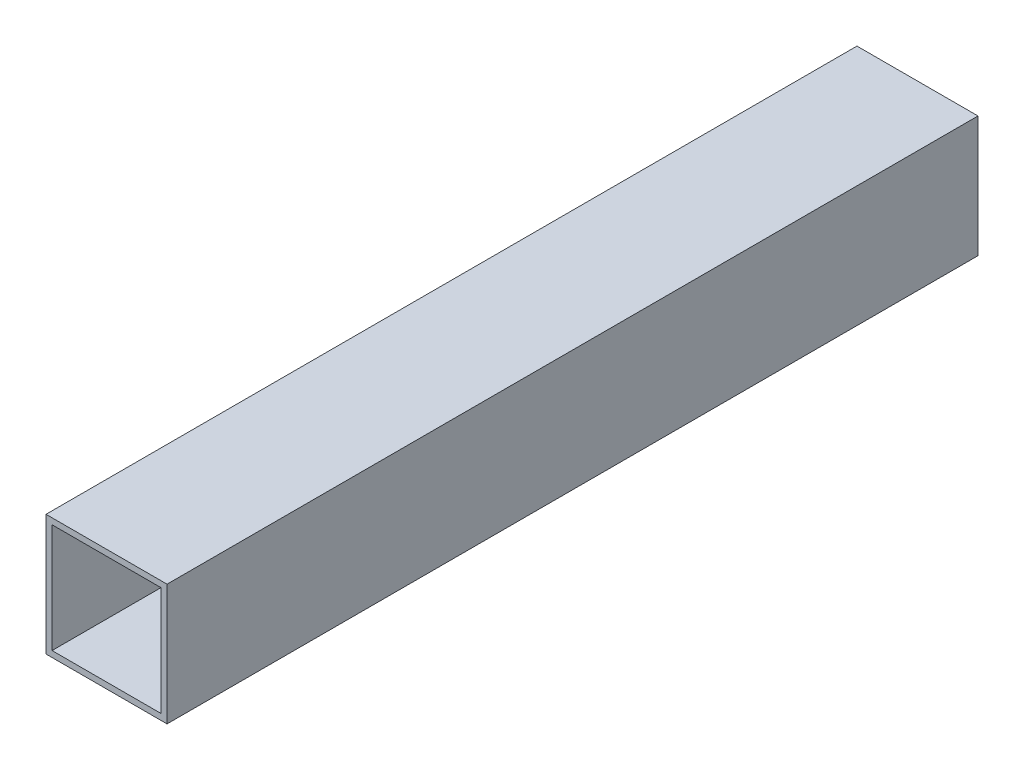
from build123d import *

# Parameters (mm, degrees)
CROQUIS1_W            = 40
CROQUIS1_H            = 40
CROQUIS1_W_2          = 36
CROQUIS1_H_2          = 36
EXTRUIR_L_MINA1_DEPTH = 268


with BuildPart() as part:
    # Croquis1 → Extruir-Lámina1 (new body)
    with BuildSketch(Plane.XY):
        Rectangle(CROQUIS1_W, CROQUIS1_H)
        Rectangle(CROQUIS1_W_2, CROQUIS1_H_2, mode=Mode.SUBTRACT)
    extrude(amount=EXTRUIR_L_MINA1_DEPTH)


solid = part.part
